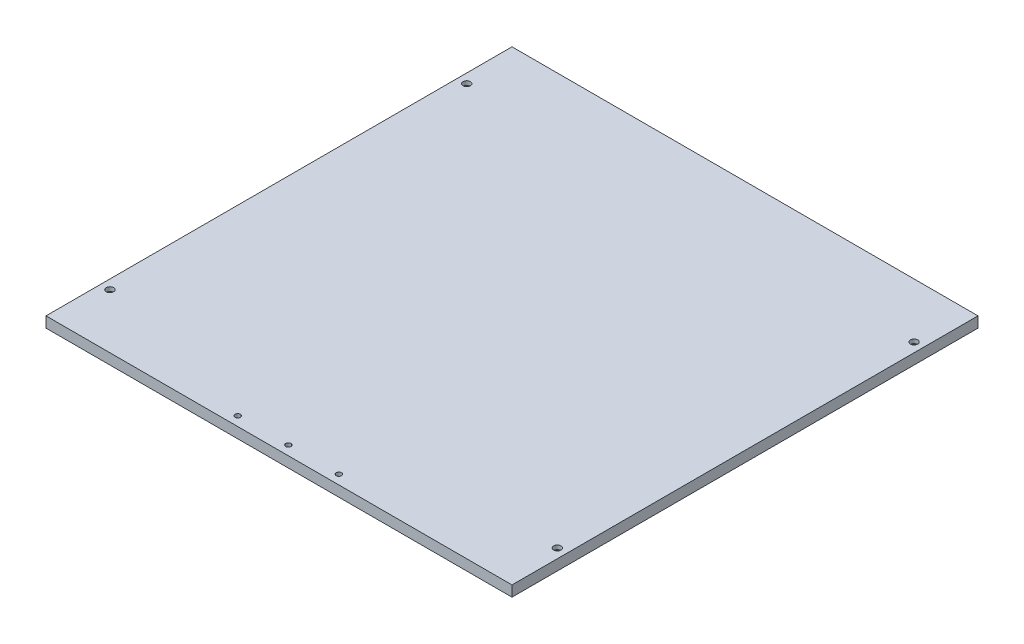
from build123d import *

# Parameters (mm, degrees)
PLATESKETCH2_W         = 350
PLATESKETCH2_H         = 350
PLATESKETCH2_R         = 2
BOSS_EXTRUDE1_DEPTH    = 8
BORESKETCH1_R          = 2.75
BORECUT_EXTRUDE1_DEPTH = 3


with BuildPart() as part:
    # PlateSketch2 → Boss-Extrude1 (new body)
    with BuildSketch(Plane(origin=(0, 0, 0), x_dir=(1, 0, 0), z_dir=(0, 1, 0))):
        with Locations((175, 175)):
            Rectangle(PLATESKETCH2_W, PLATESKETCH2_H)
        with Locations(Location((7, 309, 0), (0, 0, 270))):
            Circle(PLATESKETCH2_R, mode=Mode.SUBTRACT)
        with Locations(Location((343, 309, 0), (0, 0, 270))):
            Circle(PLATESKETCH2_R, mode=Mode.SUBTRACT)
        with Locations(Location((137, 7, 0), (0, 0, 270))):
            Circle(PLATESKETCH2_R, mode=Mode.SUBTRACT)
        with Locations(Location((175, 7, 0), (0, 0, 270))):
            Circle(PLATESKETCH2_R, mode=Mode.SUBTRACT)
        with Locations(Location((213, 7, 0), (0, 0, 270))):
            Circle(PLATESKETCH2_R, mode=Mode.SUBTRACT)
        with Locations(Location((7, 41, 0), (0, 0, 270))):
            Circle(PLATESKETCH2_R, mode=Mode.SUBTRACT)
        with Locations(Location((343, 41, 0), (0, 0, 270))):
            Circle(PLATESKETCH2_R, mode=Mode.SUBTRACT)
    extrude(amount=BOSS_EXTRUDE1_DEPTH)

    # BoreSketch1 → BoreCut-Extrude1 (cut)
    with BuildSketch(Plane(origin=(0, 8, 0), x_dir=(1, 0, 0), z_dir=(0, 1, 0))):
        with Locations(Location((7, 309, 0), (0, 0, 270))):
            Circle(BORESKETCH1_R)
        with Locations(Location((343, 309, 0), (0, 0, 270))):
            Circle(BORESKETCH1_R)
        with Locations(Location((7, 41, 0), (0, 0, 270))):
            Circle(BORESKETCH1_R)
        with Locations(Location((343, 41, 0), (0, 0, 270))):
            Circle(BORESKETCH1_R)
    extrude(amount=-BORECUT_EXTRUDE1_DEPTH, mode=Mode.SUBTRACT)


solid = part.part
